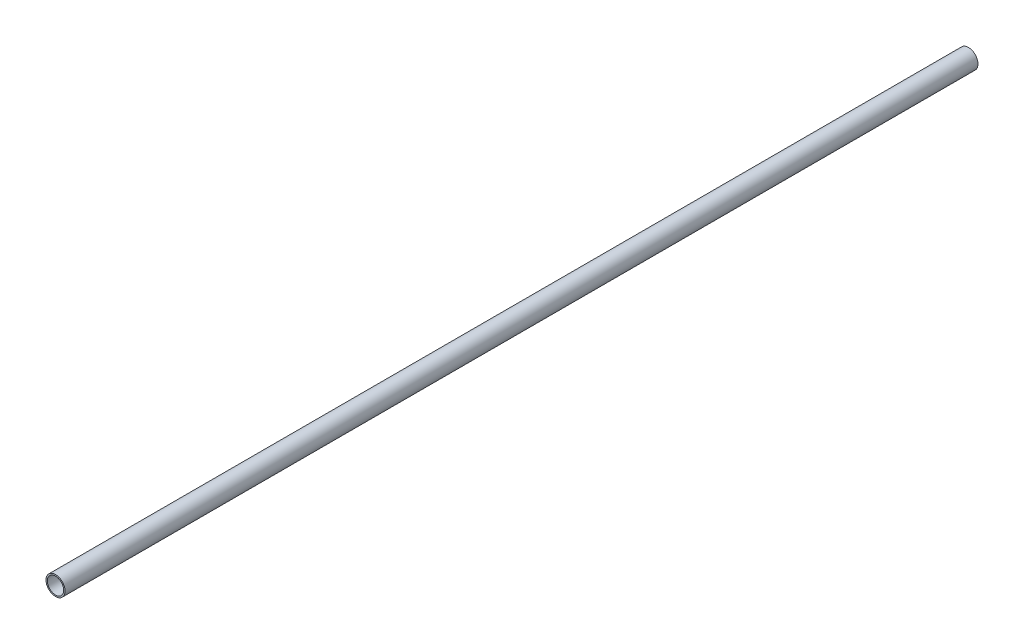
from build123d import *

# Parameters (mm, degrees)
BOSS_EXTRUDE1_DEPTH      = 335.28
BOSS_EXTRUDE1_DEPTH_BACK = 335.28
SKETCH1_R                = 7
SKETCH1_R_2              = 6


with BuildPart() as part:
    # Sketch1 → Boss-Extrude1 (new, two sides: drawn at the far end of the back side and taken through both)
    with BuildSketch(Plane.XY.offset(-BOSS_EXTRUDE1_DEPTH_BACK)):
        Circle(SKETCH1_R)
        Circle(SKETCH1_R_2, mode=Mode.SUBTRACT)
    extrude(amount=BOSS_EXTRUDE1_DEPTH + BOSS_EXTRUDE1_DEPTH_BACK)


solid = part.part
